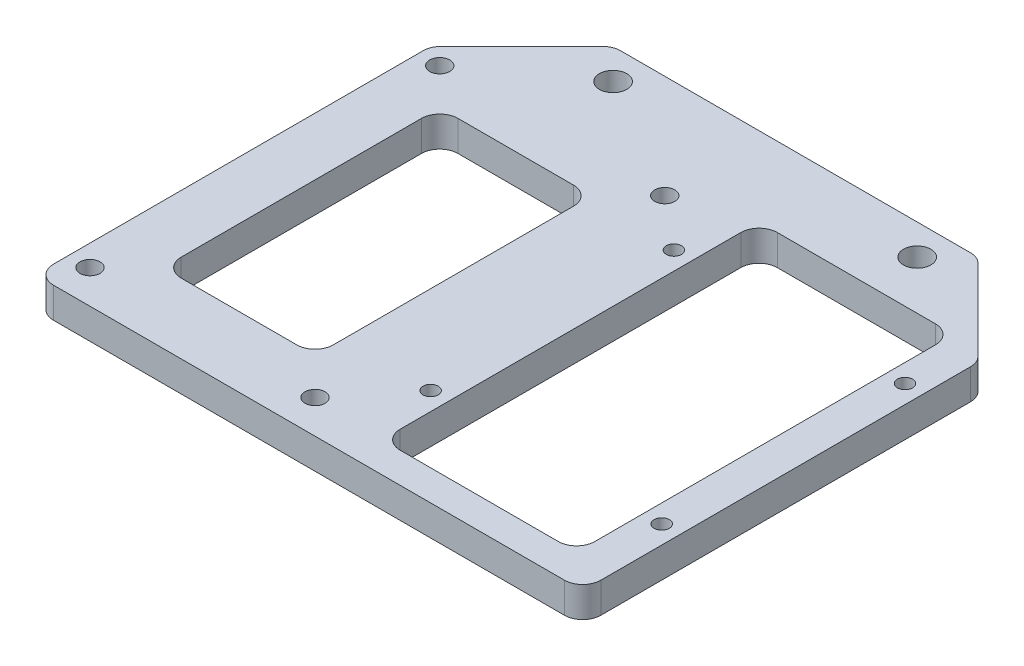
from build123d import *

# Parameters (mm, degrees)
SKETCH1_W           = 90
SKETCH1_H           = 80
SKETCH1_R           = 2.25
SKETCH1_R_2         = 1.65
SKETCH1_R_3         = 1.25
SKETCH1_W_2         = 32
SKETCH1_H_2         = 62
SKETCH1_W_3         = 25
SKETCH1_H_3         = 45.5
BOSS_EXTRUDE1_DEPTH = 5
CHAMFER1_SIZE       = 15
FILLET1_R           = 3


with BuildPart() as part:
    # Sketch1 → Boss-Extrude1 (new body)
    with BuildSketch(Plane(origin=(0, 0, 0), x_dir=(1, 0, 0), z_dir=(0, 1, 0))):
        Rectangle(SKETCH1_W, SKETCH1_H)
        with Locations(Location((-25, 35, 0), (0, 0, 270))):
            Circle(SKETCH1_R, mode=Mode.SUBTRACT)
        with Locations(Location((25, 35, 0), (0, 0, 90))):
            Circle(SKETCH1_R, mode=Mode.SUBTRACT)
        with Locations(Location((-41.5, 23, 0), (0, 0, 270))):
            Circle(SKETCH1_R_2, mode=Mode.SUBTRACT)
        with Locations(Location((-4.5, 23, 0), (0, 0, 270))):
            Circle(SKETCH1_R_2, mode=Mode.SUBTRACT)
        with Locations(Location((-4.5, -34.5, 0), (0, 0, 270))):
            Circle(SKETCH1_R_2, mode=Mode.SUBTRACT)
        with Locations(Location((-41.5, -34.5, 0), (0, 0, 270))):
            Circle(SKETCH1_R_2, mode=Mode.SUBTRACT)
        with Locations(Location((4, 16, 0), (0, 0, 270))):
            Circle(SKETCH1_R_3, mode=Mode.SUBTRACT)
        with Locations(Location((42, 16, 0), (0, 0, 270))):
            Circle(SKETCH1_R_3, mode=Mode.SUBTRACT)
        with Locations(Location((42, -24, 0), (0, 0, 270))):
            Circle(SKETCH1_R_3, mode=Mode.SUBTRACT)
        with Locations(Location((4, -24, 0), (0, 0, 270))):
            Circle(SKETCH1_R_3, mode=Mode.SUBTRACT)
        with Locations((23, -4)):
            Rectangle(SKETCH1_W_2, SKETCH1_H_2, mode=Mode.SUBTRACT)
        with Locations((-23, -5.75)):
            Rectangle(SKETCH1_W_3, SKETCH1_H_3, mode=Mode.SUBTRACT)
    extrude(amount=BOSS_EXTRUDE1_DEPTH)

    # Chamfer1
    chamfer1_edges = [part.edges().sort_by_distance(p)[0] for p in [
        (-45, 2.5, -40),
        (45, 2.5, -40),
    ]]
    chamfer(chamfer1_edges, length=CHAMFER1_SIZE)

    # Fillet1
    fillet1_edges = [part.edges().sort_by_distance(p)[0] for p in [
        (7, 2.5, -27),
        (7, 2.5, 35),
        (39, 2.5, 35),
        (39, 2.5, -27),
        (-35.5, 2.5, -17),
        (-35.5, 2.5, 28.5),
        (-10.5, 2.5, 28.5),
        (-10.5, 2.5, -17),
        (45, 2.5, 40),
        (-45, 2.5, 40),
        (-30, 2.5, -40),
        (30, 2.5, -40),
        (45, 2.5, -25),
        (-45, 2.5, -25),
    ]]
    fillet(fillet1_edges, radius=FILLET1_R)


solid = part.part
